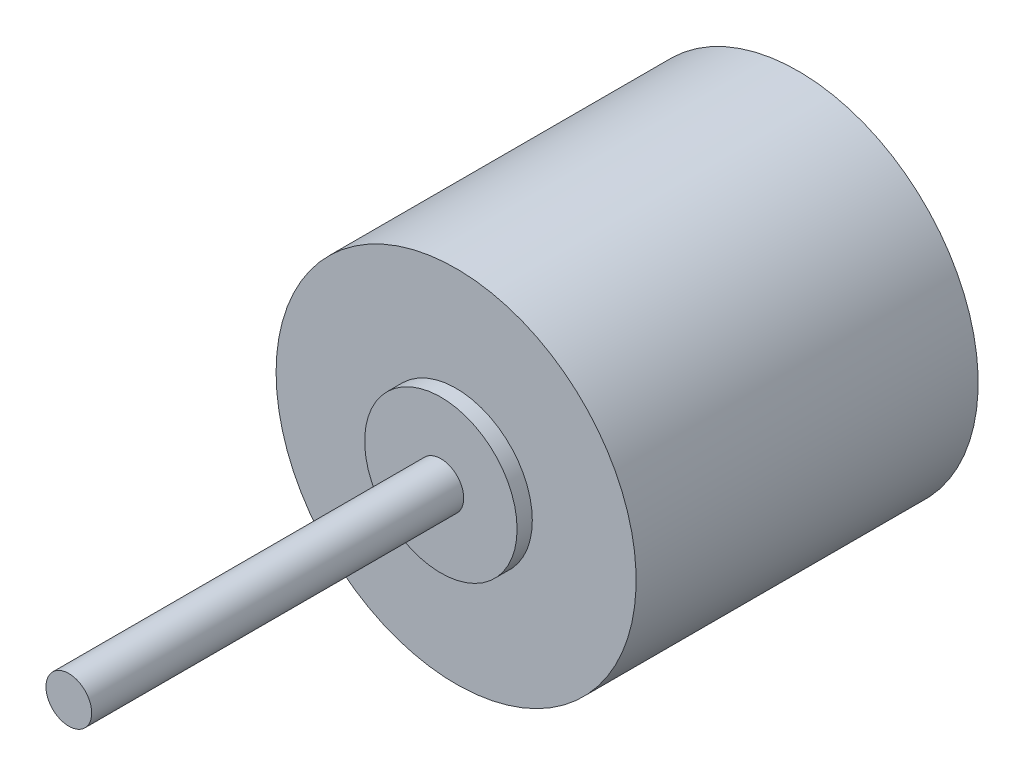
from build123d import *

# Parameters (mm, degrees)
SKETCH1_R           = 30
BOSS_EXTRUDE1_DEPTH = 57
SKETCH2_R           = 12.7
BOSS_EXTRUDE2_DEPTH = 2.54
SKETCH3_R           = 3.81
BOSS_EXTRUDE3_DEPTH = 62
SKETCH4_R           = 2
CUT_EXTRUDE1_DEPTH  = 5.08


with BuildPart() as part:
    # Sketch1 → Boss-Extrude1 (new body)
    with BuildSketch(Plane.XY):
        with Locations(Location((0, 0, 0), (0, 0, 180))):
            Circle(SKETCH1_R)
    extrude(amount=BOSS_EXTRUDE1_DEPTH)

    # Sketch2 → Boss-Extrude2 (add)
    with BuildSketch(Plane.XY.offset(57)):
        Circle(SKETCH2_R)
    extrude(amount=BOSS_EXTRUDE2_DEPTH)

    # Sketch3 → Boss-Extrude3 (add)
    with BuildSketch(Plane.XY.offset(59.54)):
        Circle(SKETCH3_R)
    extrude(amount=BOSS_EXTRUDE3_DEPTH)

    # Sketch4 → Cut-Extrude1 (cut)
    with BuildSketch(Plane(origin=(0, 0, 0), x_dir=(-1, 0, 0), z_dir=(0, 0, -1))):
        with Locations((0, -16)):
            Circle(SKETCH4_R)
        with Locations((-16, 0)):
            Circle(SKETCH4_R)
        with Locations((0, 16)):
            Circle(SKETCH4_R)
        with Locations((16, 0)):
            Circle(SKETCH4_R)
    extrude(amount=-CUT_EXTRUDE1_DEPTH, mode=Mode.SUBTRACT)


solid = part.part
